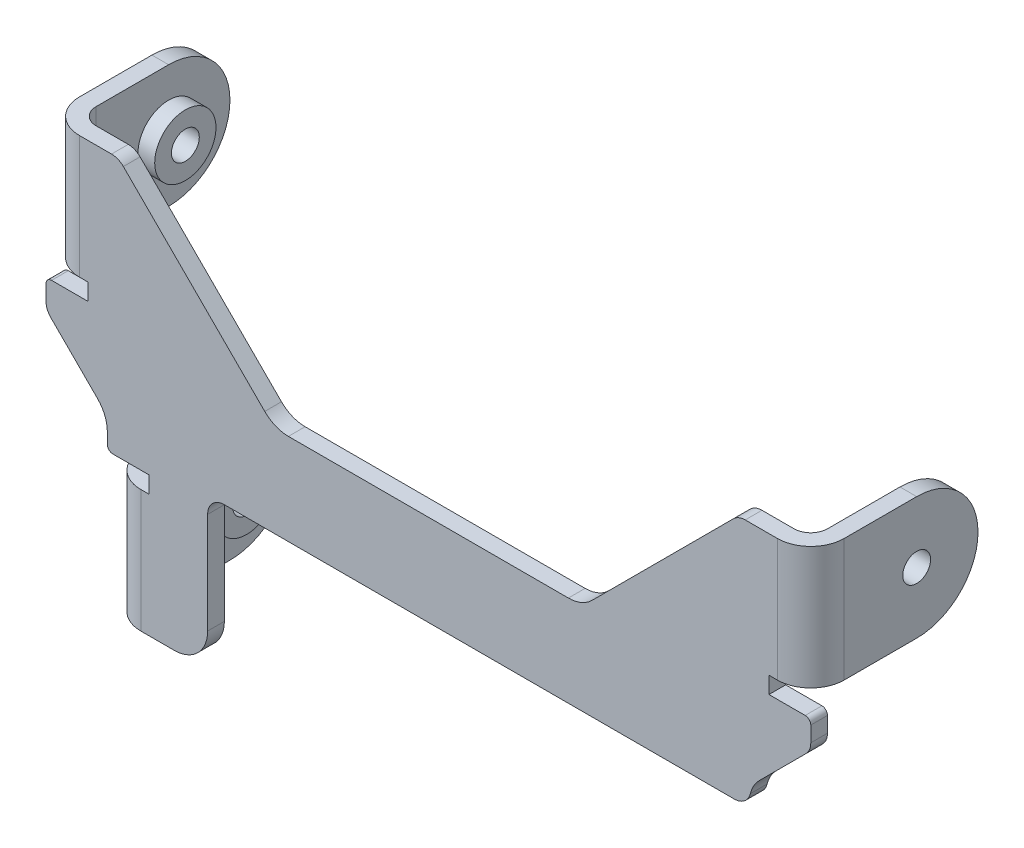
from build123d import *

# Parameters (mm, degrees)
SKETCH_1_W                  = 5.5
SKETCH_1_H                  = 12.242640687
EXTRUDE_1_DEPTH             = 1.5
SKETCH_2_W                  = 1.5
SKETCH_2_H                  = 24.742640687
EXTRUDE_2_DEPTH             = 55.6
SKETCH_3_W                  = 1.5
SKETCH_3_H                  = 11
EXTRUDE_3_DEPTH             = 2.25
SKETCH_4_W                  = 63.35
SKETCH_4_H                  = 1.5
EXTRUDE_4_DEPTH             = 11
EXTRUDE_5_DEPTH             = 1.5
EXTRUDE_6_DEPTH             = 1.5
SKETCH_7_W                  = 1.5
SKETCH_7_H                  = 11
EXTRUDE_7_DEPTH             = 2.25
EXTRUDE_START               = 1.5
EXTRUDE_8_DEPTH             = 1.5
SKETCH_9_W                  = 1.5
SKETCH_9_H                  = 23.242640687
EXTRUDE_9_DEPTH             = 3.75
SKETCH_10_W                 = 1.5
SKETCH_10_H                 = 10.742640687
EXTRUDE_10_DEPTH            = 3.75
CUT_EXTRUDE_1_DEPTH         = 83.797705282
SKETCH_12_W                 = 54.1
SKETCH_12_H                 = 13.565555211
CUT_EXTRUDE_2_DEPTH         = 83.797705282
CUT_EXTRUDE_3_DEPTH         = 83.797705282
CUT_EXTRUDE_4_DEPTH         = 83.797705282
SKETCH_15_W                 = 1.5
SKETCH_15_H                 = 2.75
SKETCH_16_W                 = 1.5
SKETCH_16_H                 = 2.75
SKETCH_17_W                 = 1.5
SKETCH_17_H                 = 2.75
HOLE_WIZARD_2_5_2_5_1_D     = 2.5
HOLE_WIZARD_2_5_2_5_1_DEPTH = 63.1
HOLE_WIZARD_2_5_2_5_2_D     = 2.5
HOLE_WIZARD_2_5_2_5_2_DEPTH = 3
HOLE_WIZARD_2_5_2_5_3_D     = 2.5
HOLE_WIZARD_2_5_2_5_3_DEPTH = 68.6
FILLET_1_R                  = 0.5
FILLET_2_R                  = 1.5
FILLET_3_R                  = 3


with BuildPart() as part:
    # 草图1 → 凸台-拉伸1 (new body)
    with BuildSketch(Plane.XY):
        with Locations((4, 30.878679657)):
            Rectangle(SKETCH_1_W, SKETCH_1_H)
    extrude(amount=-EXTRUDE_1_DEPTH)

    # 草图2 → 凸台-拉伸2 (add)
    with BuildSketch(Plane(origin=(6.75, 0, 0), x_dir=(0, 0, -1), z_dir=(1, 0, 0))):
        with Locations((0.75, 24.628679657)):
            Rectangle(SKETCH_2_W, SKETCH_2_H)
    extrude(amount=EXTRUDE_2_DEPTH)

    # 草图3 → 凸台-拉伸3 (add)
    with BuildSketch(Plane.ZY.offset(-6.75)):
        with Locations((-0.75, 17.757359313)):
            Rectangle(SKETCH_3_W, SKETCH_3_H)
    extrude(amount=EXTRUDE_3_DEPTH)

    # 草图4 → 凸台-拉伸4 (add)
    with BuildSketch(Plane(origin=(0, 37, 0), x_dir=(-1, 0, 0), z_dir=(0, 1, 0))):
        with Locations((-30.675, -0.75)):
            Rectangle(SKETCH_4_W, SKETCH_4_H)
    extrude(amount=EXTRUDE_4_DEPTH)

    # 草图5 → 凸台-拉伸5 (add)
    with BuildSketch(Plane.ZY.offset(1)):
        with BuildLine():
            Line((-9.5, 48), (0, 48))
            Line((0, 48), (0, 37))
            Line((0, 37), (-9.5, 37))
            ThreePointArc((-9.5, 37), (-15, 42.5), (-9.5, 48))
        make_face()
    extrude(amount=EXTRUDE_5_DEPTH)

    # 草图6 → 凸台-拉伸6 (add)
    with BuildSketch(Plane.ZY.offset(-4.5)):
        with BuildLine():
            Line((-9.5, 23.257359313), (0, 23.257359313))
            Line((0, 23.257359313), (0, 12.257359313))
            Line((0, 12.257359313), (-9.5, 12.257359313))
            ThreePointArc((-9.5, 12.257359313), (-15, 17.757359313), (-9.5, 23.257359313))
        make_face()
    extrude(amount=EXTRUDE_6_DEPTH)

    # 草图7 → 凸台-拉伸7 (add)
    with BuildSketch(Plane(origin=(62.35, 0, 0), x_dir=(0, 0, -1), z_dir=(1, 0, 0))):
        with Locations((0.75, 42.5)):
            Rectangle(SKETCH_7_W, SKETCH_7_H)
    extrude(amount=EXTRUDE_7_DEPTH)

    # 草图8 → 凸台-拉伸8 (add)
    with BuildSketch(Plane(origin=(64.6, 0, 0), x_dir=(0, 0, -1), z_dir=(1, 0, 0)).offset(EXTRUDE_START)):
        with BuildLine():
            Line((9.5, 37), (0, 37))
            Line((0, 37), (0, 48))
            Line((0, 48), (9.5, 48))
            ThreePointArc((9.5, 48), (15, 42.5), (9.5, 37))
        make_face()
    extrude(amount=-EXTRUDE_8_DEPTH)

    # 草图9 → 凸台-拉伸9 (add)
    with BuildSketch(Plane(origin=(62.35, 0, 0), x_dir=(0, 0, -1), z_dir=(1, 0, 0))):
        with Locations((0.75, 23.878679657)):
            Rectangle(SKETCH_9_W, SKETCH_9_H)
    extrude(amount=EXTRUDE_9_DEPTH)

    # 草图10 → 凸台-拉伸10 (add)
    with BuildSketch(Plane.ZY.offset(-1.25)):
        with Locations((-0.75, 30.128679657)):
            Rectangle(SKETCH_10_W, SKETCH_10_H)
    extrude(amount=EXTRUDE_10_DEPTH)

    # 草图11 → 切除-拉伸1 (cut, through all)
    with BuildSketch(Plane(origin=(0, 0, -1.5), x_dir=(-1, 0, 0), z_dir=(0, 0, -1))):
        Polygon((2.5, 24.757359313), (2.5, 33), (-3, 27.5), (-3, 24.757359313), align=None)
    extrude(amount=-CUT_EXTRUDE_1_DEPTH, mode=Mode.SUBTRACT)

    # 草图12 → 切除-拉伸2 (cut, through all)
    with BuildSketch(Plane(origin=(0, 0, -1.5), x_dir=(-1, 0, 0), z_dir=(0, 0, -1))):
        with Locations((-39.05, 19.040136919)):
            Rectangle(SKETCH_12_W, SKETCH_12_H)
    extrude(amount=-CUT_EXTRUDE_2_DEPTH, mode=Mode.SUBTRACT)

    # 草图13 → 切除-拉伸3 (cut, through all)
    with BuildSketch(Plane(origin=(0, 0, -1.5), x_dir=(-1, 0, 0), z_dir=(0, 0, -1))):
        with BuildLine():
            Line((-61.478679656, 28.378679656), (-66.1, 33))
            Line((-66.1, 33), (-66.1, 25.822914524))
            Line((-66.1, 25.822914524), (-60.631623722, 25.822914524))
            ThreePointArc((-60.631623722, 25.822914524), (-60.752327832, 27.201161847), (-61.478679656, 28.378679656))
        make_face()
    extrude(amount=-CUT_EXTRUDE_3_DEPTH, mode=Mode.SUBTRACT)

    # 草图14 → 切除-拉伸4 (cut, through all)
    with BuildSketch(Plane(origin=(0, 0, -1.5), x_dir=(-1, 0, 0), z_dir=(0, 0, -1))):
        Polygon((-59.6, 48), (-45.6, 34), (-18, 34), (-4, 48), align=None)
    extrude(amount=-CUT_EXTRUDE_4_DEPTH, mode=Mode.SUBTRACT)

    # 草图15 → 旋转1 (revolve)
    with BuildSketch(Plane(origin=(0, 0, -9.5), x_dir=(-1, 0, 0), z_dir=(0, 0, -1)), mode=Mode.PRIVATE) as revolve_1_sk:
        with Locations((-5.25, 19.132359313)):
            Rectangle(SKETCH_15_W, SKETCH_15_H)
    revolve(revolve_1_sk.sketch.rotate(Axis((6, 17.757359313, -9.5), (-1, 0, 0)), 270), axis=Axis((6, 17.757359313, -9.5), (-1, 0, 0)))

    # 草图16 → 旋转2 (revolve)
    with BuildSketch(Plane(origin=(0, 0, -9.5), x_dir=(-1, 0, 0), z_dir=(0, 0, -1)), mode=Mode.PRIVATE) as revolve_2_sk:
        with Locations((0.25, 43.875)):
            Rectangle(SKETCH_16_W, SKETCH_16_H)
    revolve(revolve_2_sk.sketch.rotate(Axis((0.5, 42.5, -9.5), (-1, 0, 0)), 270), axis=Axis((0.5, 42.5, -9.5), (-1, 0, 0)))

    # 草图17 → 旋转3 (revolve)
    with BuildSketch(Plane.XY.offset(-9.5), mode=Mode.PRIVATE) as revolve_3_sk:
        with Locations((63.85, 43.875)):
            Rectangle(SKETCH_17_W, SKETCH_17_H)
    revolve(revolve_3_sk.sketch.rotate(Axis((63.1, 42.5, -9.5), (1, 0, 0)), 270), axis=Axis((63.1, 42.5, -9.5), (1, 0, 0)))

    # Ø2.5 (2.5) 直径孔1
    with Locations(Plane.ZY.offset(-3)):
        with Locations((-9.5, 17.757359313)):
            Hole(HOLE_WIZARD_2_5_2_5_1_D / 2, depth=HOLE_WIZARD_2_5_2_5_1_DEPTH)

    # Ø2.5 (2.5) 直径孔2
    with Locations(Plane.ZY.offset(2.5)):
        with Locations((-9.5, 42.5)):
            Hole(HOLE_WIZARD_2_5_2_5_2_D / 2, depth=HOLE_WIZARD_2_5_2_5_2_DEPTH)

    # Ø2.5 (2.5) 直径孔3
    with Locations(Plane(origin=(66.1, 0, 0), x_dir=(0, 0, -1), z_dir=(1, 0, 0))):
        with Locations((9.5, 42.5)):
            Hole(HOLE_WIZARD_2_5_2_5_3_D / 2, depth=HOLE_WIZARD_2_5_2_5_3_DEPTH)

    # 圆角1
    fillet_1_edges = [part.edges().sort_by_distance(p)[0] for p in [
        (66.1, 35.5, -0.75),
        (-2.5, 35.5, -0.75),
        (3, 24.757359313, -0.75),
    ]]
    fillet(fillet_1_edges, radius=FILLET_1_R)

    # 圆角2
    fillet_2_edges = [part.edges().sort_by_distance(p)[0] for p in [
        (-2.5, 33, -0.75),
        (12, 25.822914524, -0.75),
        (60.631623722, 25.822914524, -0.75),
        (66.1, 33, -0.75),
        (59.6, 48, -0.75),
        (4, 48, -0.75),
        (4.5, 17.757359313, -1.5),
        (-1, 42.5, -1.5),
        (64.6, 42.5, -1.5),
    ]]
    fillet(fillet_2_edges, radius=FILLET_2_R)

    # 圆角3
    fillet_3_edges = [part.edges().sort_by_distance(p)[0] for p in [
        (66.1, 42.5, 0),
        (18, 34, -0.75),
        (45.6, 34, -0.75),
        (3, 27.5, -0.75),
        (12, 12.257359313, -0.75),
        (3, 17.757359313, 0),
        (-2.5, 42.5, 0),
    ]]
    fillet(fillet_3_edges, radius=FILLET_3_R)


solid = part.part
